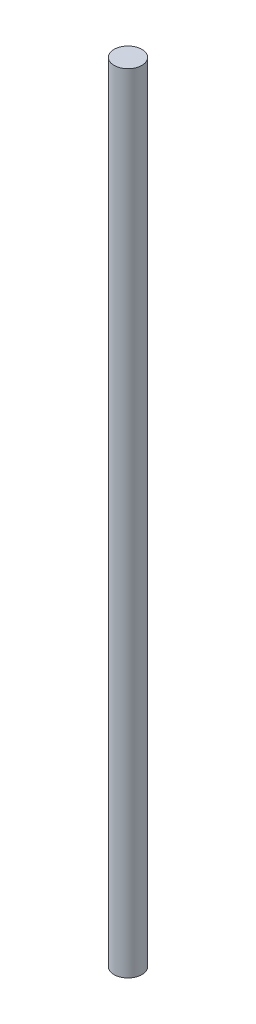
from build123d import *

# Parameters (mm, degrees)
SKETCH1_R           = 21.082
BOSS_EXTRUDE1_DEPTH = 596.9


with BuildPart() as part:
    # Sketch1 → Boss-Extrude1 (new, symmetric)
    with BuildSketch(Plane(origin=(0, 0, 0), x_dir=(-1, 0, 0), z_dir=(0, 1, 0))):
        with Locations(Location((0, 0, 0), (0, 0, 90))):
            Circle(SKETCH1_R)
    extrude(amount=BOSS_EXTRUDE1_DEPTH, both=True)


solid = part.part
